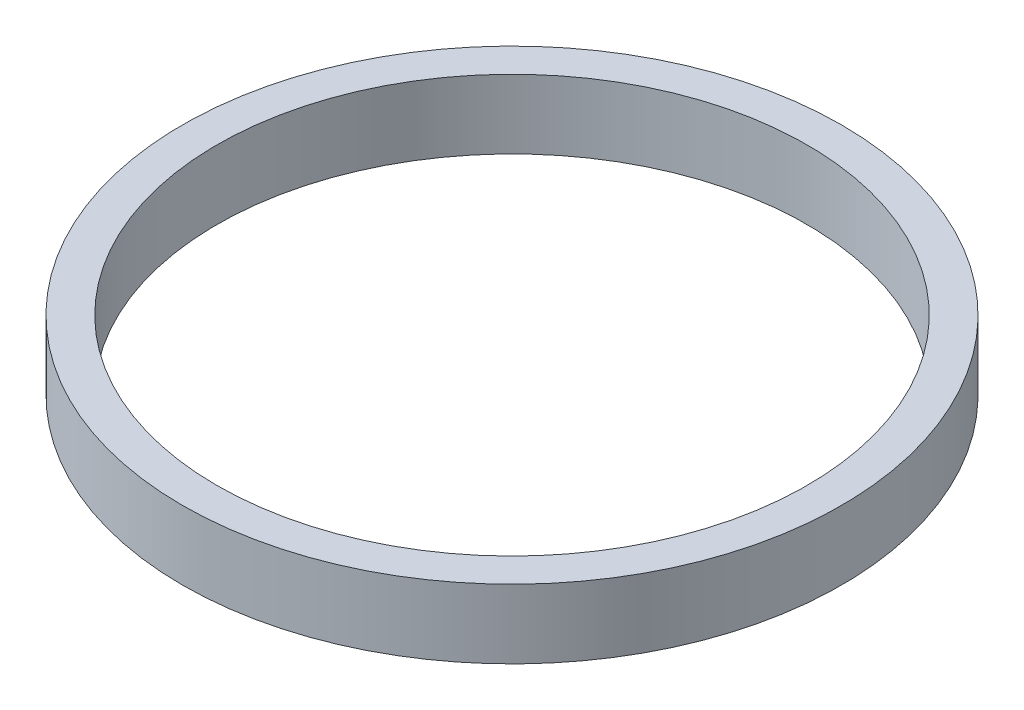
from build123d import *

# Parameters (mm, degrees)
SKETCH1_R           = 47.75
SKETCH1_R_2         = 42.75
BOSS_EXTRUDE1_DEPTH = 10


with BuildPart() as part:
    # Sketch1 → Boss-Extrude1 (new body)
    with BuildSketch(Plane(origin=(0, 0, 0), x_dir=(1, 0, 0), z_dir=(0, 1, 0))):
        with Locations(Location((0, 0, 0), (0, 0, 270))):
            Circle(SKETCH1_R)
        with Locations(Location((0, 0, 0), (0, 0, 270))):
            Circle(SKETCH1_R_2, mode=Mode.SUBTRACT)
    extrude(amount=BOSS_EXTRUDE1_DEPTH)


solid = part.part
